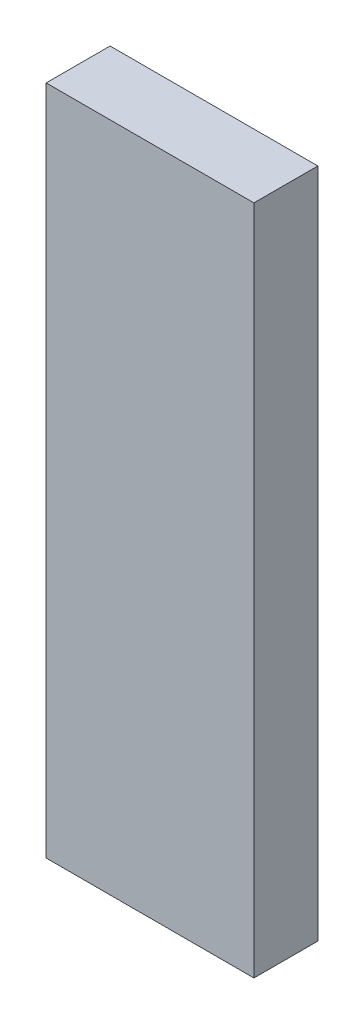
from build123d import *

# Parameters (mm, degrees)
SKETCH1_W           = 65
SKETCH1_H           = 210
BOSS_EXTRUDE1_DEPTH = 20


with BuildPart() as part:
    # Sketch1 → Boss-Extrude1 (new body)
    with BuildSketch(Plane.XY):
        Rectangle(SKETCH1_W, SKETCH1_H)
    extrude(amount=BOSS_EXTRUDE1_DEPTH)


solid = part.part
